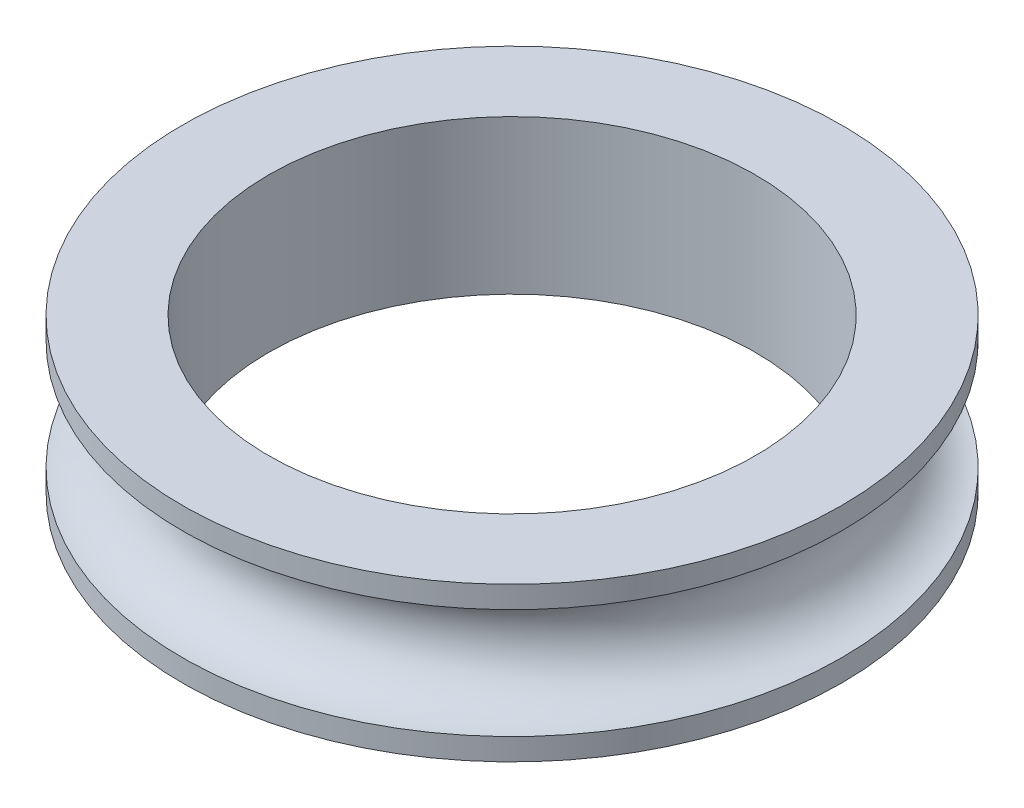
from build123d import *

# Parameters (mm, degrees)
SKETCH4_R          = 11.075
CUT_EXTRUDE1_DEPTH = 23.338307904


with BuildPart() as part:
    # Sketch2 → Revolve1 (revolve)
    with BuildSketch(Plane.XY):
        with BuildLine():
            Line((-15, 2.5), (-15, 3.5))
            Line((-15, 3.5), (0, 3.5))
            Line((0, 3.5), (0, -3.5))
            Line((0, -3.5), (-15, -3.5))
            Line((-15, -3.5), (-15, -2.5))
            ThreePointArc((-15, -2.5), (-12.5, 0), (-15, 2.5))
        make_face()
    revolve(axis=Axis((0, -3.5, 0), (0, 1, 0)))

    # Sketch4 → Cut-Extrude1 (cut, through all)
    with BuildSketch(Plane(origin=(0, 3.5, 0), x_dir=(1, 0, 0), z_dir=(0, 1, 0))):
        Circle(SKETCH4_R)
    extrude(amount=-CUT_EXTRUDE1_DEPTH, mode=Mode.SUBTRACT)


solid = part.part
